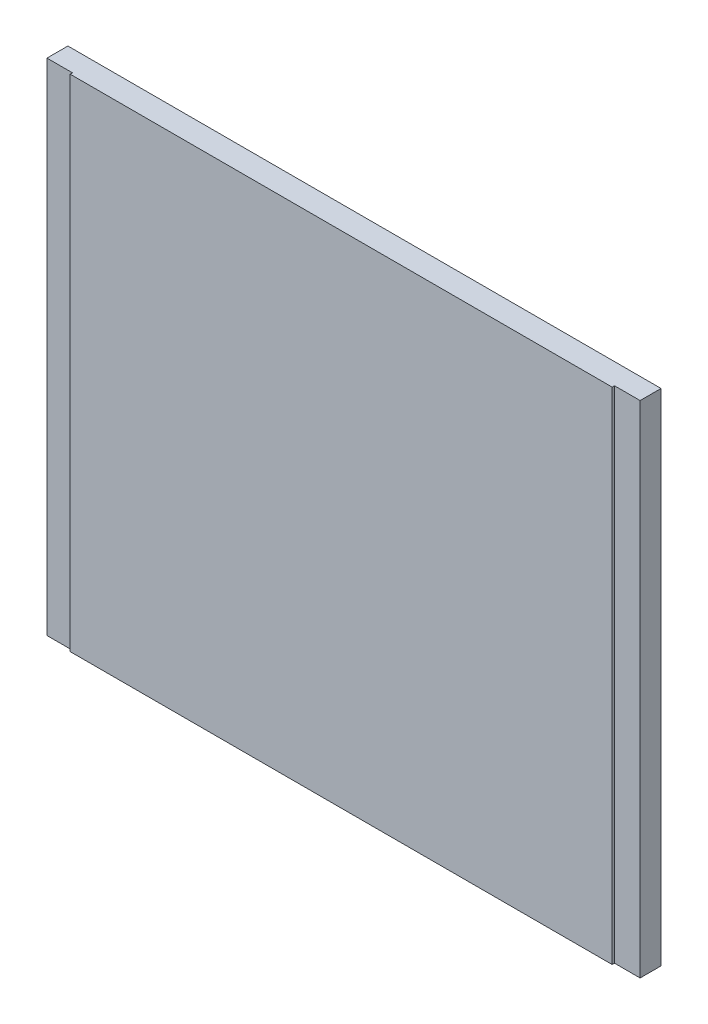
from build123d import *

# Parameters (mm, degrees)
ESQUISSE1_W             = 255
ESQUISSE1_H             = 215
BOSS_EXTRU_1_DEPTH      = 10
ESQUISSE2_W             = 11
ESQUISSE2_H             = 215
ENL_V_MAT_EXTRU_1_DEPTH = 1


with BuildPart() as part:
    # Esquisse1 → Boss.-Extru.1 (new body)
    with BuildSketch(Plane.XY):
        Rectangle(ESQUISSE1_W, ESQUISSE1_H)
    extrude(amount=BOSS_EXTRU_1_DEPTH)

    # Esquisse2 → Enlèv. mat.-Extru.1 (cut)
    with BuildSketch(Plane.XY.offset(10)):
        with Locations((-122, 0)):
            Rectangle(ESQUISSE2_W, ESQUISSE2_H)
        with Locations((122, 0)):
            Rectangle(ESQUISSE2_W, ESQUISSE2_H)
    extrude(amount=-ENL_V_MAT_EXTRU_1_DEPTH, mode=Mode.SUBTRACT)


solid = part.part
